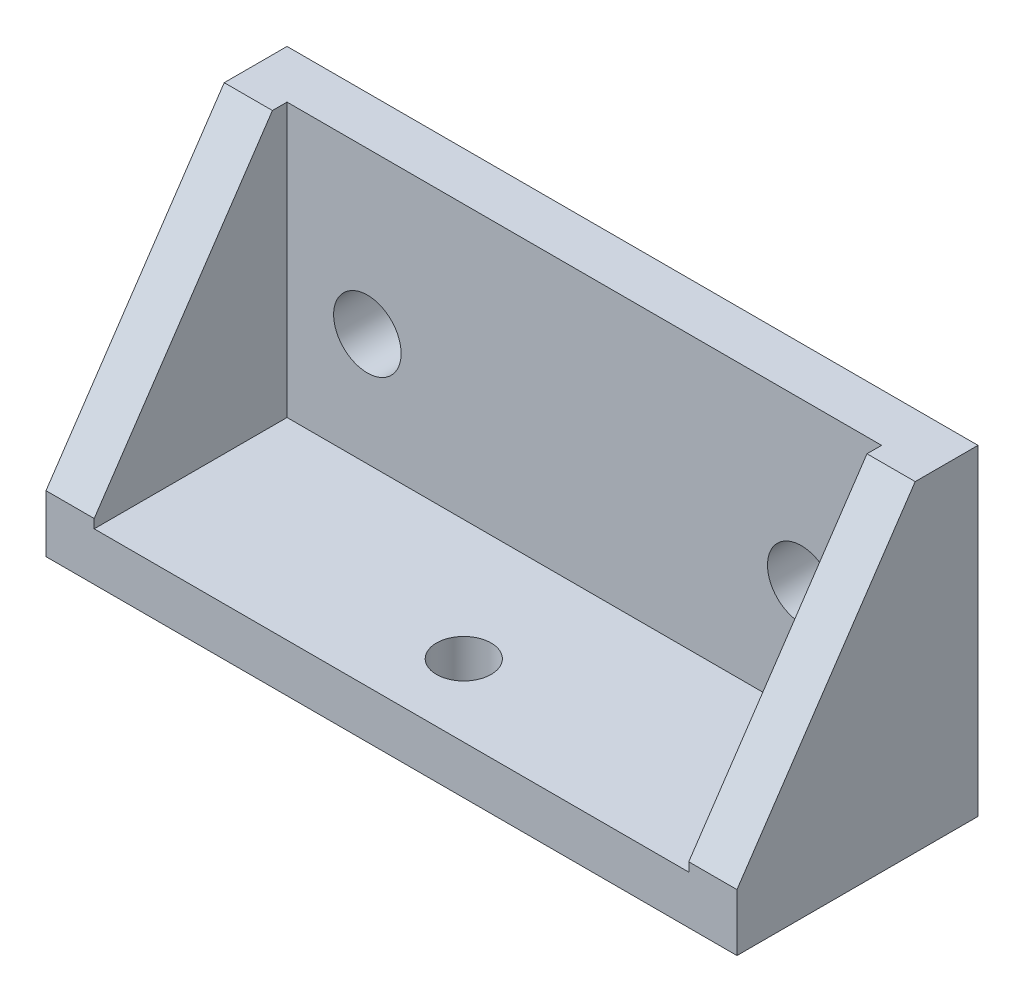
from build123d import *

# Parameters (mm, degrees)
BOSS_EXTRUDE3_DEPTH = 21.5
SKETCH4_W           = 37
SKETCH4_H           = 12
CUT_EXTRUDE1_DEPTH  = 17
SKETCH5_R           = 2.1
CUT_EXTRUDE2_DEPTH  = 32.721443851
SKETCH6_R           = 1.7
CUT_EXTRUDE3_DEPTH  = 32.2449996


with BuildPart() as part:
    # Sketch3 → Boss-Extrude3 (new, symmetric)
    with BuildSketch(Plane(origin=(0, 0, 0), x_dir=(0, 0, -1), z_dir=(1, 0, 0))):
        Polygon((0, 0), (0, 20), (-3.90885, 20), (-15, 3.55669), (-15, 0), align=None)
    extrude(amount=BOSS_EXTRUDE3_DEPTH, both=True)

    # Sketch4 → Cut-Extrude1 (cut)
    with BuildSketch(Plane(origin=(0, 20, 0), x_dir=(1, 0, 0), z_dir=(0, 1, 0))):
        with Locations((0, -9)):
            Rectangle(SKETCH4_W, SKETCH4_H)
    extrude(amount=-CUT_EXTRUDE1_DEPTH, mode=Mode.SUBTRACT)

    # Sketch5 → Cut-Extrude2 (cut, through all)
    with BuildSketch(Plane.XY.offset(3)):
        with Locations((-13.5, 10)):
            Circle(SKETCH5_R)
        with Locations((13.5, 10)):
            Circle(SKETCH5_R)
    extrude(amount=-CUT_EXTRUDE2_DEPTH, mode=Mode.SUBTRACT)

    # Sketch6 → Cut-Extrude3 (cut, through all)
    with BuildSketch(Plane(origin=(0, 3, 0), x_dir=(1, 0, 0), z_dir=(0, 1, 0))):
        with Locations(Location((0, -10.5, 0), (0, 0, 270))):
            Circle(SKETCH6_R)
    extrude(amount=-CUT_EXTRUDE3_DEPTH, mode=Mode.SUBTRACT)


solid = part.part
